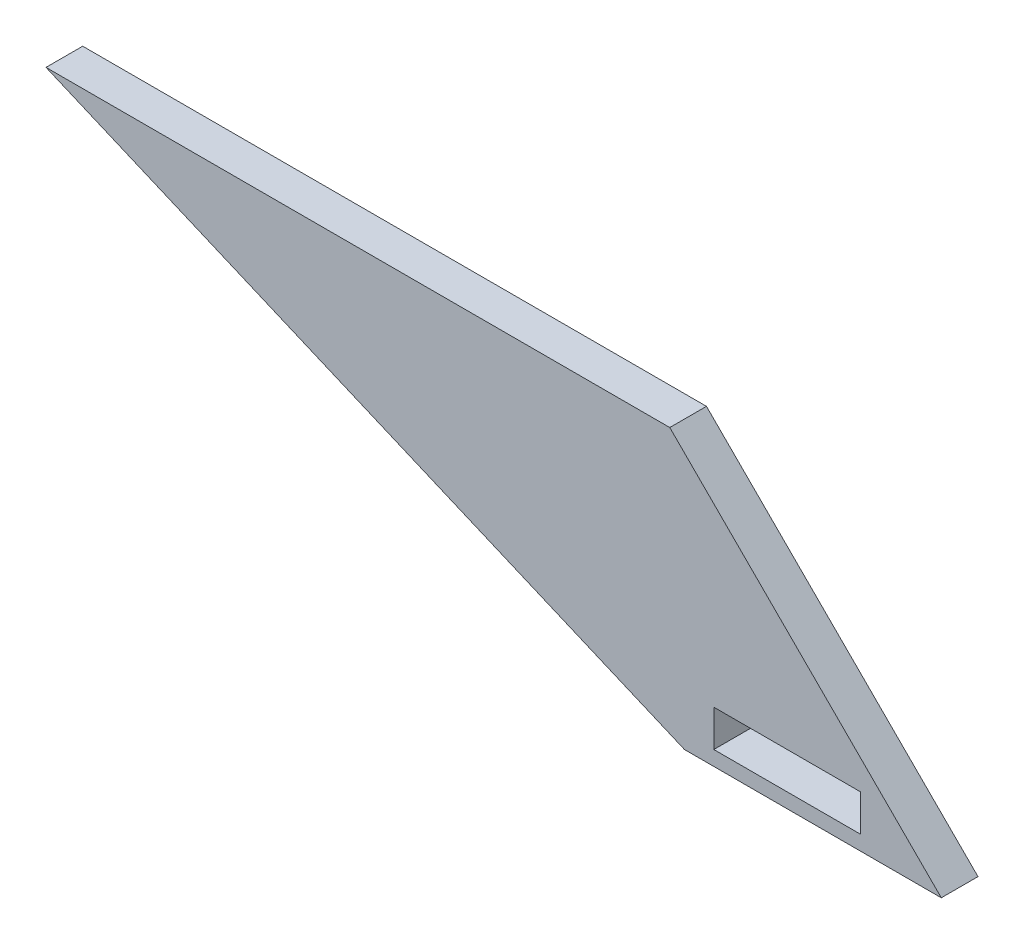
from build123d import *

# Parameters (mm, degrees)
BOSS_EXTRUDE2_DEPTH = 5
SKETCH3_W           = 20
SKETCH3_H           = 5
CUT_EXTRUDE1_DEPTH  = 10


with BuildPart() as part:
    # Sketch2 → Boss-Extrude2 (new body)
    with BuildSketch(Plane.XY):
        Polygon((-72.082465124, 43.596680205), (12.917534876, 43.596680205), (49.917534876, 6.596680205), (14.917534876, 6.596680205), align=None)
    extrude(amount=BOSS_EXTRUDE2_DEPTH)

    # Sketch3 → Cut-Extrude1 (cut)
    with BuildSketch(Plane.XY.offset(5)):
        with Locations((28.917534876, 11.096680205)):
            Rectangle(SKETCH3_W, SKETCH3_H)
    extrude(amount=-CUT_EXTRUDE1_DEPTH, mode=Mode.SUBTRACT)


solid = part.part
